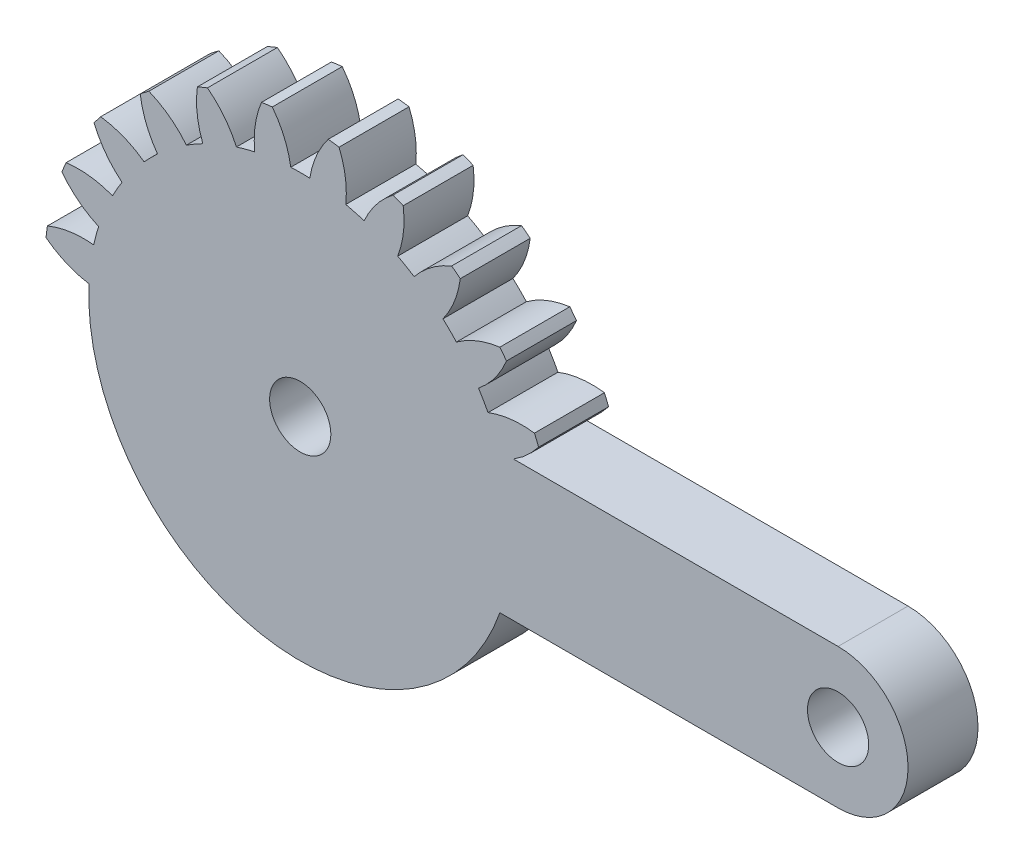
from build123d import *
from build123d.topology import SkipClean

# Parameters (mm, degrees)
SKETCH1_R           = 1.75
BOSS_EXTRUDE1_DEPTH = 4
CUT_EXTRUDE1_DEPTH  = 29.891595766


with BuildPart() as part:
    # Sketch1 → Boss-Extrude1 (new body)
    with BuildSketch(Plane.XY):
        with BuildLine():
            Line((20.64, 4), (2.08, 4))
            ThreePointArc((2.08, 4), (2.859386397, 4.588201733), (3.5201075, 5.30713988))
            ThreePointArc((3.5201075, 5.30713988), (3.403753673, 5.596745198), (3.281246369, 5.883801663))
            ThreePointArc((3.281246369, 5.883801663), (1.933634043, 5.894040025), (0.625453025, 5.57027124))
            ThreePointArc((0.625453025, 5.57027124), (0.364644212, 6.046375), (0.082730667, 6.510293938))
            ThreePointArc((0.082730667, 6.510293938), (1.017213169, 7.48132754), (1.68215265, 8.65351323))
            ThreePointArc((1.68215265, 8.65351323), (1.494808112, 8.903135899), (1.302179463, 9.148703928))
            ThreePointArc((1.302179463, 9.148703928), (-0.002163969, 8.809805691), (-1.181972273, 8.158486898))
            ThreePointArc((-1.181972273, 8.158486898), (-1.557118962, 8.550865528), (-1.949497592, 8.926012217))
            ThreePointArc((-1.949497592, 8.926012217), (-1.298178799, 10.105820521), (-0.959280562, 11.410163953))
            ThreePointArc((-0.959280562, 11.410163953), (-1.204848591, 11.602792602), (-1.45447126, 11.79013714))
            ThreePointArc((-1.45447126, 11.79013714), (-2.62665695, 11.125197659), (-3.597690552, 10.190715157))
            ThreePointArc((-3.597690552, 10.190715157), (-4.06160949, 10.472628702), (-4.53771325, 10.733437515))
            ThreePointArc((-4.53771325, 10.733437515), (-4.213944465, 12.041618533), (-4.224182827, 13.389230859))
            ThreePointArc((-4.224182827, 13.389230859), (-4.511239292, 13.511738163), (-4.80084461, 13.62809199))
            ThreePointArc((-4.80084461, 13.62809199), (-5.760990039, 12.682425791), (-6.457074605, 11.528463019))
            ThreePointArc((-6.457074605, 11.528463019), (-6.978150482, 11.680699536), (-7.505533688, 11.809396783))
            ThreePointArc((-7.505533688, 11.809396783), (-7.531379219, 13.156800143), (-7.890056453, 14.455843809))
            ThreePointArc((-7.890056453, 14.455843809), (-8.199038929, 14.499881098), (-8.508890771, 14.537314892))
            ThreePointArc((-8.508890771, 14.537314892), (-9.191563616, 13.375367565), (-9.565262132, 12.080565177))
            ThreePointArc((-9.565262132, 12.080565177), (-10.10798449, 12.09275), (-10.650706848, 12.080565177))
            ThreePointArc((-10.650706848, 12.080565177), (-11.024405364, 13.375367565), (-11.707078209, 14.537314892))
            ThreePointArc((-11.707078209, 14.537314892), (-12.016930051, 14.499881098), (-12.325912527, 14.455843809))
            ThreePointArc((-12.325912527, 14.455843809), (-12.684589761, 13.156800143), (-12.710435292, 11.809396783))
            ThreePointArc((-12.710435292, 11.809396783), (-13.237818498, 11.680699536), (-13.758894375, 11.528463019))
            ThreePointArc((-13.758894375, 11.528463019), (-14.454978941, 12.682425791), (-15.41512437, 13.62809199))
            ThreePointArc((-15.41512437, 13.62809199), (-15.704729688, 13.511738163), (-15.991786153, 13.389230859))
            ThreePointArc((-15.991786153, 13.389230859), (-16.002024515, 12.041618533), (-15.67825573, 10.733437515))
            ThreePointArc((-15.67825573, 10.733437515), (-16.15435949, 10.472628702), (-16.618278428, 10.190715157))
            ThreePointArc((-16.618278428, 10.190715157), (-17.58931203, 11.125197659), (-18.76149772, 11.79013714))
            ThreePointArc((-18.76149772, 11.79013714), (-19.011120389, 11.602792602), (-19.256688418, 11.410163953))
            ThreePointArc((-19.256688418, 11.410163953), (-18.917790181, 10.105820521), (-18.266471388, 8.926012217))
            ThreePointArc((-18.266471388, 8.926012217), (-18.658850018, 8.550865528), (-19.033996707, 8.158486898))
            ThreePointArc((-19.033996707, 8.158486898), (-20.213805011, 8.809805691), (-21.518148443, 9.148703928))
            ThreePointArc((-21.518148443, 9.148703928), (-21.710777092, 8.903135899), (-21.89812163, 8.65351323))
            ThreePointArc((-21.89812163, 8.65351323), (-21.233182149, 7.48132754), (-20.298699647, 6.510293938))
            ThreePointArc((-20.298699647, 6.510293938), (-20.580613192, 6.046375), (-20.841422005, 5.57027124))
            ThreePointArc((-20.841422005, 5.57027124), (-22.149603023, 5.894040025), (-23.497215349, 5.883801663))
            ThreePointArc((-23.497215349, 5.883801663), (-23.619722653, 5.596745198), (-23.73607648, 5.30713988))
            ThreePointArc((-23.73607648, 5.30713988), (-22.790410282, 4.346994451), (-21.636447509, 3.650909885))
            ThreePointArc((-21.636447509, 3.650909885), (-21.788684026, 3.129834008), (-21.917381273, 2.602450802))
            ThreePointArc((-21.917381273, 2.602450802), (-23.264784633, 2.576605271), (-24.563828299, 2.217928037))
            ThreePointArc((-24.563828299, 2.217928037), (-24.607865588, 1.908945561), (-24.645299382, 1.599093719))
            ThreePointArc((-24.645299382, 1.599093719), (-23.483352055, 0.916420874), (-22.188549667, 0.542722358))
            ThreePointArc((-22.188549667, 0.542722358), (-22.20073449, 0), (-22.188549667, -0.542722358))
            ThreePointArc((-22.188549667, -0.542722358), (-23.483352055, -0.916420874), (-24.645299382, -1.599093719))
            ThreePointArc((-24.645299382, -1.599093719), (-24.607865588, -1.908945561), (-24.563828299, -2.217928037))
            ThreePointArc((-24.563828299, -2.217928037), (-23.264784633, -2.576605271), (-21.917381273, -2.602450802))
            ThreePointArc((-21.917381273, -2.602450802), (-21.788684026, -3.129834008), (-21.636447509, -3.650909885))
            ThreePointArc((-21.636447509, -3.650909885), (-22.790410282, -4.346994451), (-23.73607648, -5.30713988))
            ThreePointArc((-23.73607648, -5.30713988), (-23.619722653, -5.596745198), (-23.497215349, -5.883801663))
            ThreePointArc((-23.497215349, -5.883801663), (-22.149603023, -5.894040025), (-20.841422005, -5.57027124))
            ThreePointArc((-20.841422005, -5.57027124), (-20.580613192, -6.046375), (-20.298699647, -6.510293938))
            ThreePointArc((-20.298699647, -6.510293938), (-21.233182149, -7.48132754), (-21.89812163, -8.65351323))
            ThreePointArc((-21.89812163, -8.65351323), (-21.710777092, -8.903135899), (-21.518148443, -9.148703928))
            ThreePointArc((-21.518148443, -9.148703928), (-20.213805011, -8.809805691), (-19.033996707, -8.158486898))
            ThreePointArc((-19.033996707, -8.158486898), (-18.658850018, -8.550865528), (-18.266471388, -8.926012217))
            ThreePointArc((-18.266471388, -8.926012217), (-18.917790181, -10.105820521), (-19.256688418, -11.410163953))
            ThreePointArc((-19.256688418, -11.410163953), (-19.011120389, -11.602792602), (-18.76149772, -11.79013714))
            ThreePointArc((-18.76149772, -11.79013714), (-17.58931203, -11.125197659), (-16.618278428, -10.190715157))
            ThreePointArc((-16.618278428, -10.190715157), (-16.15435949, -10.472628702), (-15.67825573, -10.733437515))
            ThreePointArc((-15.67825573, -10.733437515), (-16.002024515, -12.041618533), (-15.991786153, -13.389230859))
            ThreePointArc((-15.991786153, -13.389230859), (-15.704729688, -13.511738163), (-15.41512437, -13.62809199))
            ThreePointArc((-15.41512437, -13.62809199), (-14.454978941, -12.682425791), (-13.758894375, -11.528463019))
            ThreePointArc((-13.758894375, -11.528463019), (-13.237818498, -11.680699536), (-12.710435292, -11.809396783))
            ThreePointArc((-12.710435292, -11.809396783), (-12.684589761, -13.156800143), (-12.325912527, -14.455843809))
            ThreePointArc((-12.325912527, -14.455843809), (-12.016930051, -14.499881098), (-11.707078209, -14.537314892))
            ThreePointArc((-11.707078209, -14.537314892), (-11.024405364, -13.375367565), (-10.650706848, -12.080565177))
            ThreePointArc((-10.650706848, -12.080565177), (-10.10798449, -12.09275), (-9.565262132, -12.080565177))
            ThreePointArc((-9.565262132, -12.080565177), (-9.191563616, -13.375367565), (-8.508890771, -14.537314892))
            ThreePointArc((-8.508890771, -14.537314892), (-8.199038929, -14.499881098), (-7.890056453, -14.455843809))
            ThreePointArc((-7.890056453, -14.455843809), (-7.531379219, -13.156800143), (-7.505533688, -11.809396783))
            ThreePointArc((-7.505533688, -11.809396783), (-6.978150482, -11.680699536), (-6.457074605, -11.528463019))
            ThreePointArc((-6.457074605, -11.528463019), (-5.760990039, -12.682425791), (-4.80084461, -13.62809199))
            ThreePointArc((-4.80084461, -13.62809199), (-4.511239292, -13.511738163), (-4.224182827, -13.389230859))
            ThreePointArc((-4.224182827, -13.389230859), (-4.213944465, -12.041618533), (-4.53771325, -10.733437515))
            ThreePointArc((-4.53771325, -10.733437515), (-4.06160949, -10.472628702), (-3.597690552, -10.190715157))
            ThreePointArc((-3.597690552, -10.190715157), (-2.62665695, -11.125197659), (-1.45447126, -11.79013714))
            ThreePointArc((-1.45447126, -11.79013714), (-1.204848591, -11.602792602), (-0.959280562, -11.410163953))
            ThreePointArc((-0.959280562, -11.410163953), (-1.298178799, -10.105820521), (-1.949497592, -8.926012217))
            ThreePointArc((-1.949497592, -8.926012217), (-1.557118962, -8.550865528), (-1.181972273, -8.158486898))
            ThreePointArc((-1.181972273, -8.158486898), (-0.002163969, -8.809805691), (1.302179463, -9.148703928))
            ThreePointArc((1.302179463, -9.148703928), (1.494808112, -8.903135899), (1.68215265, -8.65351323))
            ThreePointArc((1.68215265, -8.65351323), (1.017213169, -7.48132754), (0.082730667, -6.510293938))
            ThreePointArc((0.082730667, -6.510293938), (0.364644212, -6.046375), (0.625453025, -5.57027124))
            ThreePointArc((0.625453025, -5.57027124), (1.933634043, -5.894040025), (3.281246369, -5.883801663))
            ThreePointArc((3.281246369, -5.883801663), (3.403753673, -5.596745198), (3.5201075, -5.30713988))
            ThreePointArc((3.5201075, -5.30713988), (2.859386397, -4.588201733), (2.08, -4))
            Line((2.08, -4), (20.64, -4))
            ThreePointArc((20.64, -4), (24.64, 0), (20.64, 4))
        make_face()
        with Locations((-10.11, 0)):
            Circle(SKETCH1_R, mode=Mode.SUBTRACT)
        with Locations((20.64, 0)):
            Circle(SKETCH1_R, mode=Mode.SUBTRACT)
    extrude(amount=BOSS_EXTRUDE1_DEPTH)

    # Sketch2 → Cut-Extrude1 (cut, through all)
    with SkipClean():  # the faces are left unmerged after this step: merging them gives an invalid solid
        with BuildSketch(Plane.XY.offset(4)):
            with BuildLine():
                ThreePointArc((3.5201075, -5.30713988), (2.859386397, -4.588201733), (2.08, -4))
                Line((2.08, -4), (1.304053127, -4))
                ThreePointArc((1.304053127, -4), (0.992554017, -4.797149927), (0.625453025, -5.57027124))
                ThreePointArc((0.625453025, -5.57027124), (1.933634043, -5.894040025), (3.281246369, -5.883801663))
                ThreePointArc((3.281246369, -5.883801663), (3.403753673, -5.596745198), (3.5201075, -5.30713988))
            make_face()
            with BuildLine():
                ThreePointArc((1.68215265, -8.65351323), (1.017213169, -7.48132754), (0.082730667, -6.510293938))
                ThreePointArc((0.082730667, -6.510293938), (-0.514160884, -7.361599771), (-1.181972273, -8.158486898))
                ThreePointArc((-1.181972273, -8.158486898), (-0.002163969, -8.809805691), (1.302179463, -9.148703928))
                ThreePointArc((1.302179463, -9.148703928), (1.494808112, -8.903135899), (1.68215265, -8.65351323))
            make_face()
            with BuildLine():
                ThreePointArc((-0.959280562, -11.410163953), (-1.298178799, -10.105820521), (-1.949497592, -8.926012217))
                ThreePointArc((-1.949497592, -8.926012217), (-2.746384719, -9.593823606), (-3.597690552, -10.190715157))
                ThreePointArc((-3.597690552, -10.190715157), (-2.62665695, -11.125197659), (-1.45447126, -11.79013714))
                ThreePointArc((-1.45447126, -11.79013714), (-1.204848591, -11.602792602), (-0.959280562, -11.410163953))
            make_face()
            with BuildLine():
                ThreePointArc((-4.224182827, -13.389230859), (-4.213944465, -12.041618533), (-4.53771325, -10.733437515))
                ThreePointArc((-4.53771325, -10.733437515), (-5.480289413, -11.172244217), (-6.457074605, -11.528463019))
                ThreePointArc((-6.457074605, -11.528463019), (-5.760990039, -12.682425791), (-4.80084461, -13.62809199))
                ThreePointArc((-4.80084461, -13.62809199), (-4.511239292, -13.511738163), (-4.224182827, -13.389230859))
            make_face()
            with BuildLine():
                ThreePointArc((-7.890056453, -14.455843809), (-7.531379219, -13.156800143), (-7.505533688, -11.809396783))
                ThreePointArc((-7.505533688, -11.809396783), (-8.529563879, -11.989294847), (-9.565262132, -12.080565177))
                ThreePointArc((-9.565262132, -12.080565177), (-9.191563616, -13.375367565), (-8.508890771, -14.537314892))
                ThreePointArc((-8.508890771, -14.537314892), (-8.199038929, -14.499881098), (-7.890056453, -14.455843809))
            make_face()
            with BuildLine():
                ThreePointArc((-11.707078209, -14.537314892), (-11.024405364, -13.375367565), (-10.650706848, -12.080565177))
                ThreePointArc((-10.650706848, -12.080565177), (-11.686405101, -11.989294847), (-12.710435292, -11.809396783))
                ThreePointArc((-12.710435292, -11.809396783), (-12.684589761, -13.156800143), (-12.325912527, -14.455843809))
                ThreePointArc((-12.325912527, -14.455843809), (-12.016930051, -14.499881098), (-11.707078209, -14.537314892))
            make_face()
            with BuildLine():
                ThreePointArc((-15.41512437, -13.62809199), (-14.454978941, -12.682425791), (-13.758894375, -11.528463019))
                ThreePointArc((-13.758894375, -11.528463019), (-14.735679567, -11.172244217), (-15.67825573, -10.733437515))
                ThreePointArc((-15.67825573, -10.733437515), (-16.002024515, -12.041618533), (-15.991786153, -13.389230859))
                ThreePointArc((-15.991786153, -13.389230859), (-15.704729688, -13.511738163), (-15.41512437, -13.62809199))
            make_face()
            with BuildLine():
                ThreePointArc((-18.76149772, -11.79013714), (-17.58931203, -11.125197659), (-16.618278428, -10.190715157))
                ThreePointArc((-16.618278428, -10.190715157), (-17.469584261, -9.593823606), (-18.266471388, -8.926012217))
                ThreePointArc((-18.266471388, -8.926012217), (-18.917790181, -10.105820521), (-19.256688418, -11.410163953))
                ThreePointArc((-19.256688418, -11.410163953), (-19.011120389, -11.602792602), (-18.76149772, -11.79013714))
            make_face()
            with BuildLine():
                ThreePointArc((-21.518148443, -9.148703928), (-20.213805011, -8.809805691), (-19.033996707, -8.158486898))
                ThreePointArc((-19.033996707, -8.158486898), (-19.701808096, -7.361599771), (-20.298699647, -6.510293938))
                ThreePointArc((-20.298699647, -6.510293938), (-21.233182149, -7.48132754), (-21.89812163, -8.65351323))
                ThreePointArc((-21.89812163, -8.65351323), (-21.710777092, -8.903135899), (-21.518148443, -9.148703928))
            make_face()
            with BuildLine():
                ThreePointArc((-23.497215349, -5.883801663), (-22.149603023, -5.894040025), (-20.841422005, -5.57027124))
                ThreePointArc((-20.841422005, -5.57027124), (-21.280228707, -4.627695077), (-21.636447509, -3.650909885))
                ThreePointArc((-21.636447509, -3.650909885), (-22.790410282, -4.346994451), (-23.73607648, -5.30713988))
                ThreePointArc((-23.73607648, -5.30713988), (-23.619722653, -5.596745198), (-23.497215349, -5.883801663))
            make_face()
            with BuildLine():
                ThreePointArc((-24.563828299, -2.217928037), (-23.264784633, -2.576605271), (-21.917381273, -2.602450802))
                ThreePointArc((-21.917381273, -2.602450802), (-22.097279337, -1.578420611), (-22.188549667, -0.542722358))
                ThreePointArc((-22.188549667, -0.542722358), (-23.483352055, -0.916420874), (-24.645299382, -1.599093719))
                ThreePointArc((-24.645299382, -1.599093719), (-24.607865588, -1.908945561), (-24.563828299, -2.217928037))
            make_face()
        extrude(amount=-CUT_EXTRUDE1_DEPTH, mode=Mode.SUBTRACT)


solid = part.part
